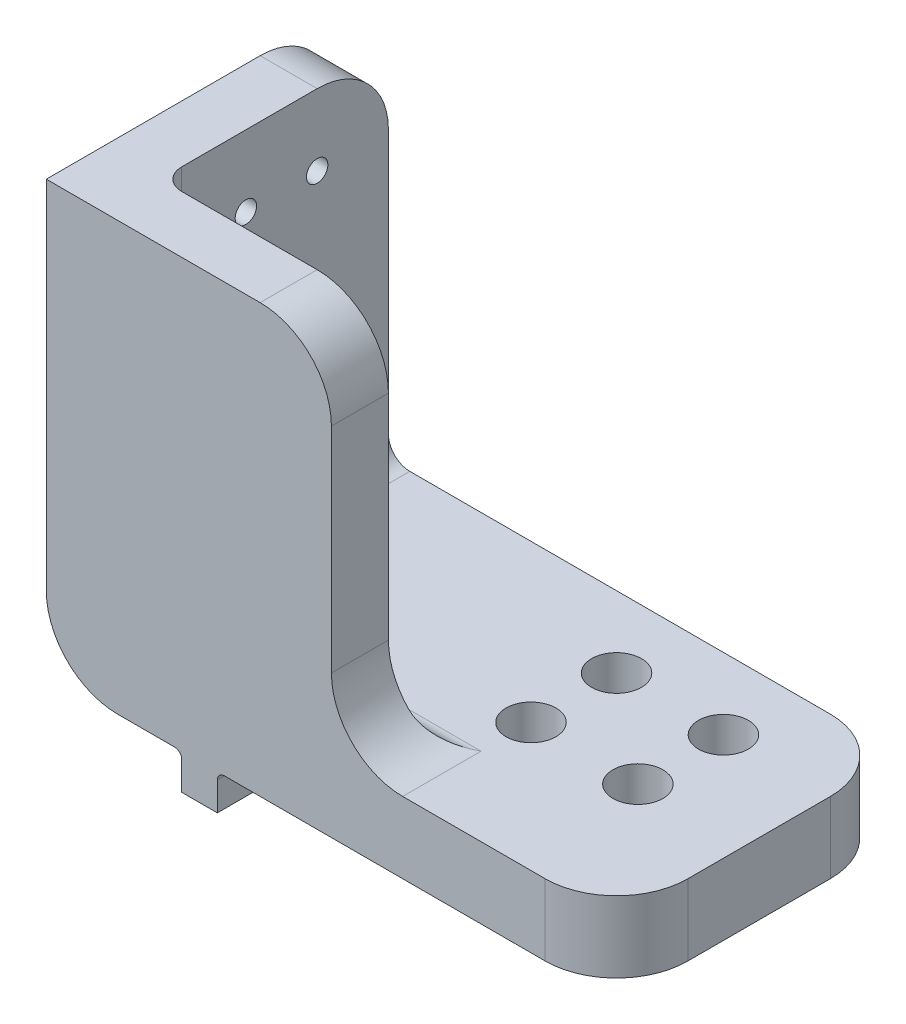
from build123d import *

# Parameters (mm, degrees)
SKETCH1_W           = 80
SKETCH1_H           = 40
SKETCH1_R           = 1.6
BOSS_EXTRUDE1_DEPTH = 10
SKETCH2_W           = 8
SKETCH2_H           = 32
SKETCH2_H_2         = 8
SKETCH2_W_2         = 32
BOSS_EXTRUDE2_DEPTH = 50
FILLET1_R           = 10
FILLET2_R           = 3
SKETCH3_R           = 3.5
CUT_EXTRUDE1_DEPTH  = 5
FILLET3_R           = 10
SKETCH4_W           = 5
SKETCH4_H           = 40
BOSS_EXTRUDE3_DEPTH = 5
FILLET4_R           = 1
SKETCH5_R           = 1.5
CUT_EXTRUDE2_DEPTH  = 80


with BuildPart() as part:
    # Sketch1 → Boss-Extrude1 (new body)
    with BuildSketch(Plane(origin=(0, 0, 0), x_dir=(1, 0, 0), z_dir=(0, 1, 0))):
        with Locations((40, 20)):
            Rectangle(SKETCH1_W, SKETCH1_H)
        with Locations(Location((65, 30, 0), (0, 0, 270))):
            Circle(SKETCH1_R, mode=Mode.SUBTRACT)
        with Locations(Location((50, 30, 0), (0, 0, 270))):
            Circle(SKETCH1_R, mode=Mode.SUBTRACT)
        with Locations(Location((50, 18, 0), (0, 0, 270))):
            Circle(SKETCH1_R, mode=Mode.SUBTRACT)
        with Locations(Location((65, 18, 0), (0, 0, 270))):
            Circle(SKETCH1_R, mode=Mode.SUBTRACT)
    extrude(amount=BOSS_EXTRUDE1_DEPTH)

    # Sketch2 → Boss-Extrude2 (add)
    with BuildSketch(Plane(origin=(0, 10, 0), x_dir=(1, 0, 0), z_dir=(0, 1, 0))):
        with Locations((4, 24)):
            Rectangle(SKETCH2_W, SKETCH2_H)
        with Locations((4, 4)):
            Rectangle(SKETCH2_W, SKETCH2_H_2)
        with Locations((24, 4)):
            Rectangle(SKETCH2_W_2, SKETCH2_H_2)
    extrude(amount=BOSS_EXTRUDE2_DEPTH)

    # Fillet1
    fillet1_edges = [part.edges().sort_by_distance(p)[0] for p in [
        (40, 10, -4),
        (40, 60, -4),
        (4, 60, -40),
        (80, 5, -40),
        (80, 5, 0),
    ]]
    fillet(fillet1_edges, radius=FILLET1_R)

    # Fillet2
    fillet2_edges = [part.edges().sort_by_distance(p)[0] for p in [
        (8, 10, -24),
        (8, 35, -8),
        (29, 10, -8),
    ]]
    fillet(fillet2_edges, radius=FILLET2_R)

    # Sketch3 → Cut-Extrude1 (cut)
    with BuildSketch(Plane(origin=(0, 10, 0), x_dir=(1, 0, 0), z_dir=(0, 1, 0))):
        with Locations(Location((50, 30, 0), (0, 0, 270))):
            Circle(SKETCH3_R)
        with Locations(Location((50, 18, 0), (0, 0, 270))):
            Circle(SKETCH3_R)
        with Locations(Location((65, 18, 0), (0, 0, 270))):
            Circle(SKETCH3_R)
        with Locations(Location((65, 30, 0), (0, 0, 270))):
            Circle(SKETCH3_R)
    extrude(amount=-CUT_EXTRUDE1_DEPTH, mode=Mode.SUBTRACT)

    # Fillet3
    fillet3_edges = [part.edges().sort_by_distance(p)[0] for p in [
        (0, 0, -20),
    ]]
    fillet(fillet3_edges, radius=FILLET3_R)

    # Sketch4 → Boss-Extrude3 (add)
    with BuildSketch(Plane.XZ):
        with Locations((21.5, -20)):
            Rectangle(SKETCH4_W, SKETCH4_H)
    extrude(amount=BOSS_EXTRUDE3_DEPTH)

    # Fillet4
    fillet4_edges = [part.edges().sort_by_distance(p)[0] for p in [
        (19, 0, -20),
        (24, 0, -20),
    ]]
    fillet(fillet4_edges, radius=FILLET4_R)

    # Sketch5 → Cut-Extrude2 (cut)
    with BuildSketch(Plane.ZY):
        with Locations((-30, 50)):
            Circle(SKETCH5_R)
        with Locations((-20, 50)):
            Circle(SKETCH5_R)
    extrude(amount=-CUT_EXTRUDE2_DEPTH, mode=Mode.SUBTRACT)


solid = part.part
